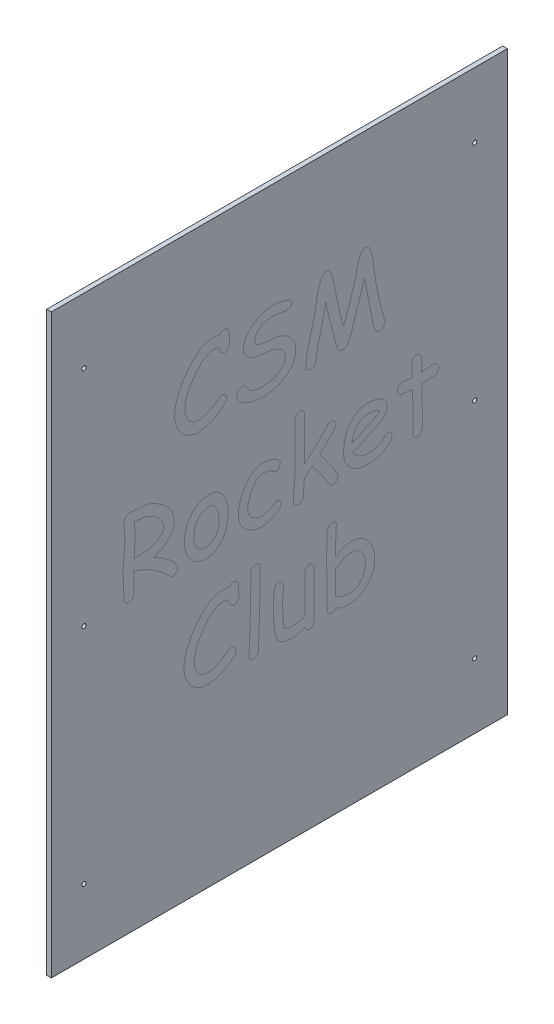
from build123d import *

# Parameters (mm, degrees)
SKETCH1_W              = 622.3
SKETCH1_H              = 787.4
BOSS_EXTRUDE1_DEPTH    = 6.35
F_10_CLEARANCE_HOLE1_D = 5.6134


with BuildPart() as part:
    # Sketch1 → Boss-Extrude1 (new body)
    with BuildSketch(Plane(origin=(0, 0, 0), x_dir=(0, 0, -1), z_dir=(1, 0, 0))):
        Rectangle(SKETCH1_W, SKETCH1_H)
    extrude(amount=BOSS_EXTRUDE1_DEPTH)

    # #10 Clearance Hole1 (through all)
    with Locations(Plane(origin=(6.35, 0, 0), x_dir=(0, 0, -1), z_dir=(1, 0, 0))):
        with Locations((-266.7, -304.8), (-266.7, 0), (-266.7, 304.8), (266.7, 304.8), (266.7, 0), (266.7, -304.8)):
            Hole(F_10_CLEARANCE_HOLE1_D / 2)


solid = part.part
